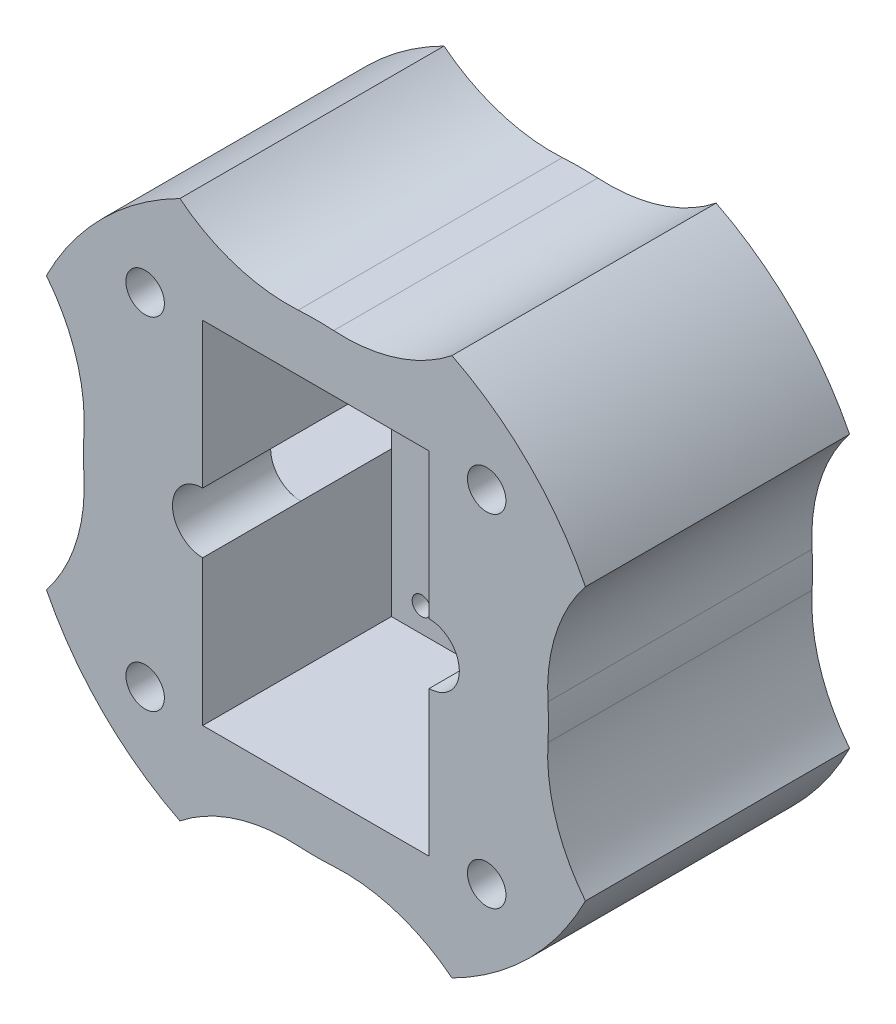
from build123d import *

# Parameters (mm, degrees)
SKETCH1_R           = 40
SKETCH1_R_2         = 6
SKETCH1_W           = 6.8
SKETCH1_H           = 1.7
BOSS_EXTRUDE1_DEPTH = 10
SKETCH3_R           = 40
SKETCH3_W           = 30
SKETCH3_H           = 46.499999994
BOSS_EXTRUDE3_DEPTH = 25
CUT_EXTRUDE1_START  = -35
CUT_EXTRUDE1_DEPTH  = 35
SKETCH5_R           = 2.55
CUT_EXTRUDE2_DEPTH  = 5
CUT_EXTRUDE3_DEPTH  = 25
SKETCH8_W           = 22
SKETCH8_H           = 8
CUT_EXTRUDE4_DEPTH  = 22


with BuildPart() as part:
    # Sketch1 → Boss-Extrude1 (new body)
    with BuildSketch(Plane.XY):
        with Locations((0, 222.499999997)):
            Circle(SKETCH1_R)
        with Locations((0, 234.5)):
            Circle(SKETCH1_R_2, mode=Mode.SUBTRACT)
        with Locations((0, 200.1)):
            Rectangle(SKETCH1_W, SKETCH1_H, mode=Mode.SUBTRACT)
        with BuildLine():
            ThreePointArc((11, 243.75), (9.75, 242.5), (11, 241.25))
            ThreePointArc((11, 241.25), (12.25, 242.5), (11, 243.75))
        make_face(mode=Mode.SUBTRACT)
        with BuildLine():
            ThreePointArc((-11, 241.25), (-9.75, 242.5), (-11, 243.75))
            ThreePointArc((-11, 243.75), (-12.25, 242.5), (-11, 241.25))
        make_face(mode=Mode.SUBTRACT)
        with BuildLine():
            ThreePointArc((11, 201.25), (12.25, 202.5), (11, 203.75))
            ThreePointArc((11, 203.75), (9.75, 202.5), (11, 201.25))
        make_face(mode=Mode.SUBTRACT)
        with BuildLine():
            ThreePointArc((-11, 201.25), (-9.75, 202.5), (-11, 203.75))
            ThreePointArc((-11, 203.75), (-12.25, 202.5), (-11, 201.25))
        make_face(mode=Mode.SUBTRACT)
    extrude(amount=BOSS_EXTRUDE1_DEPTH)

    # Sketch3 → Boss-Extrude3 (add)
    with BuildSketch(Plane.XY.offset(10)):
        with Locations((0, 222.499999997)):
            Circle(SKETCH3_R)
        with Locations((0, 222.499999997)):
            Rectangle(SKETCH3_W, SKETCH3_H, mode=Mode.SUBTRACT)
    extrude(amount=BOSS_EXTRUDE3_DEPTH)

    # Sketch4 → Cut-Extrude1 (cut)
    with BuildSketch(Plane.XY.offset(35).offset(CUT_EXTRUDE1_START)):
        with BuildLine():
            ThreePointArc((40, 222.499999997), (38.912456167, 231.763949212), (35.708962247, 240.524150885))
            ThreePointArc((35.708962247, 240.524150885), (31.77566454, 233.14486234), (30.74061322, 224.84706751))
            ThreePointArc((30.74061322, 224.84706751), (30.809531665, 222.499999997), (30.74061322, 220.152932484))
            ThreePointArc((30.74061322, 220.152932484), (31.77566454, 211.855137653), (35.708962247, 204.475849108))
            ThreePointArc((35.708962247, 204.475849108), (38.912456167, 213.236050782), (40, 222.499999997))
        make_face()
        with BuildLine():
            ThreePointArc((-2.347067513, 191.759386777), (-10.644862344, 190.724335457), (-18.024150889, 186.79103775))
            ThreePointArc((-18.024150889, 186.79103775), (0, 182.499999997), (18.024150889, 186.79103775))
            ThreePointArc((18.024150889, 186.79103775), (10.644862344, 190.724335457), (2.347067513, 191.759386777))
            ThreePointArc((2.347067513, 191.759386777), (0, 191.690468331), (-2.347067513, 191.759386777))
        make_face()
        with BuildLine():
            ThreePointArc((18.024150889, 258.208962244), (0, 262.499999997), (-18.024150889, 258.208962244))
            ThreePointArc((-18.024150889, 258.208962244), (-10.644862344, 254.275664537), (-2.347067513, 253.240613217))
            ThreePointArc((-2.347067513, 253.240613217), (0, 253.309531662), (2.347067513, 253.240613217))
            ThreePointArc((2.347067513, 253.240613217), (10.644862344, 254.275664537), (18.024150889, 258.208962244))
        make_face()
        with BuildLine():
            ThreePointArc((-30.74061322, 220.152932484), (-30.809531665, 222.499999997), (-30.74061322, 224.84706751))
            ThreePointArc((-30.74061322, 224.84706751), (-31.77566454, 233.14486234), (-35.708962247, 240.524150885))
            ThreePointArc((-35.708962247, 240.524150885), (-40, 222.499999997), (-35.708962247, 204.475849108))
            ThreePointArc((-35.708962247, 204.475849108), (-31.77566454, 211.855137653), (-30.74061322, 220.152932484))
        make_face()
    extrude(amount=CUT_EXTRUDE1_DEPTH, mode=Mode.SUBTRACT)

    # Sketch5 → Cut-Extrude2 (cut)
    with BuildSketch(Plane.XY.offset(35)):
        with Locations((-22.627416998, 245.127416995)):
            Circle(SKETCH5_R)
        with Locations(Location((22.627416998, 245.127416995, 0), (0, 0, 180))):
            Circle(SKETCH5_R)
        with Locations((22.627416998, 199.872582999)):
            Circle(SKETCH5_R)
        with Locations(Location((-22.627416998, 199.872582999, 0), (0, 0, 180))):
            Circle(SKETCH5_R)
    extrude(amount=-CUT_EXTRUDE2_DEPTH, mode=Mode.SUBTRACT)

    # Sketch6 → Cut-Extrude3 (cut)
    with BuildSketch(Plane.XY.offset(35)):
        with BuildLine():
            Line((-15, 218.499999997), (-15, 226.499999997))
            ThreePointArc((-15, 226.499999997), (-19, 222.499999997), (-15, 218.499999997))
        make_face()
        with BuildLine():
            Line((15, 218.499999997), (15, 226.499999997))
            ThreePointArc((15, 226.499999997), (19, 222.499999997), (15, 218.499999997))
        make_face()
    extrude(amount=-CUT_EXTRUDE3_DEPTH, mode=Mode.SUBTRACT)

    # Sketch8 → Cut-Extrude4 (cut)
    with BuildSketch(Plane(origin=(-15, 0, 0), x_dir=(0, 0, -1), z_dir=(1, 0, 0))):
        with Locations((-11, 222.499999997)):
            Rectangle(SKETCH8_W, SKETCH8_H)
    extrude(amount=-CUT_EXTRUDE4_DEPTH, mode=Mode.SUBTRACT)


solid = part.part
